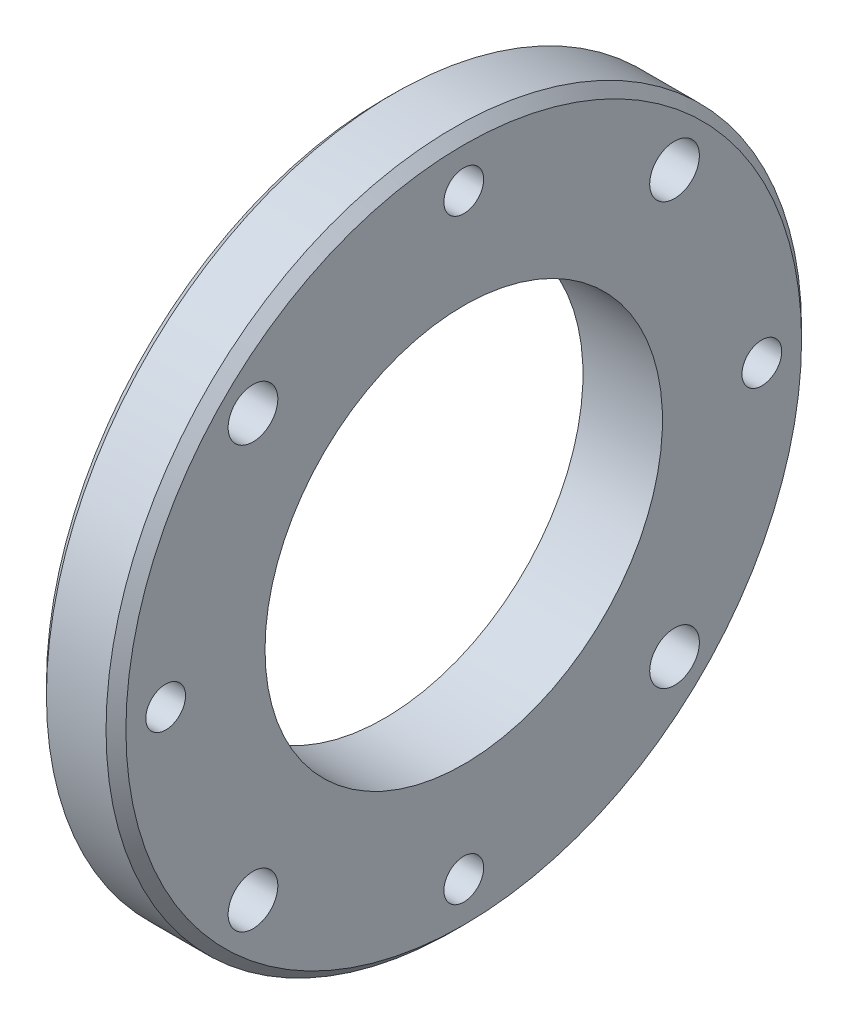
from build123d import *

# Parameters (mm, degrees)
ESQUISSE1_W             = 8
ESQUISSE1_H             = 15
CHANFREIN1_SIZE         = 1
ESQUISSE3_R             = 2
ESQUISSE3_R_2           = 2.5
ENL_V_MAT_EXTRU_2_DEPTH = 51.139804547


with BuildPart() as part:
    # Esquisse1 → Base-Révolution (revolve)
    with BuildSketch(Plane.XY, mode=Mode.PRIVATE) as base_r_volution_sk:
        with Locations((4, 27.5)):
            Rectangle(ESQUISSE1_W, ESQUISSE1_H)
    revolve(base_r_volution_sk.sketch.rotate(Axis((0, 0, 0), (1, 0, 0)), 90), axis=Axis((0, 0, 0), (1, 0, 0)))

    # Chanfrein1
    chanfrein1_edges = [part.edges().sort_by_distance(p)[0] for p in [
        (0, 0, -35),
        (8, 0, -35),
    ]]
    chamfer(chanfrein1_edges, length=CHANFREIN1_SIZE)

    # Esquisse3 → Enlèv. mat.-Extru.2 (cut, through all)
    with BuildSketch(Plane.ZY):
        with Locations((0, 30)):
            Circle(ESQUISSE3_R)
        with Locations((21.213203436, 21.213203436)):
            Circle(ESQUISSE3_R_2)
        with Locations((30, 0)):
            Circle(ESQUISSE3_R)
        with Locations((21.213203436, -21.213203436)):
            Circle(ESQUISSE3_R_2)
        with Locations((0, -30)):
            Circle(ESQUISSE3_R)
        with Locations((-21.213203436, -21.213203436)):
            Circle(ESQUISSE3_R_2)
        with Locations((-30, 0)):
            Circle(ESQUISSE3_R)
        with Locations((-21.213203436, 21.213203436)):
            Circle(ESQUISSE3_R_2)
    extrude(amount=-ENL_V_MAT_EXTRU_2_DEPTH, mode=Mode.SUBTRACT)


solid = part.part
